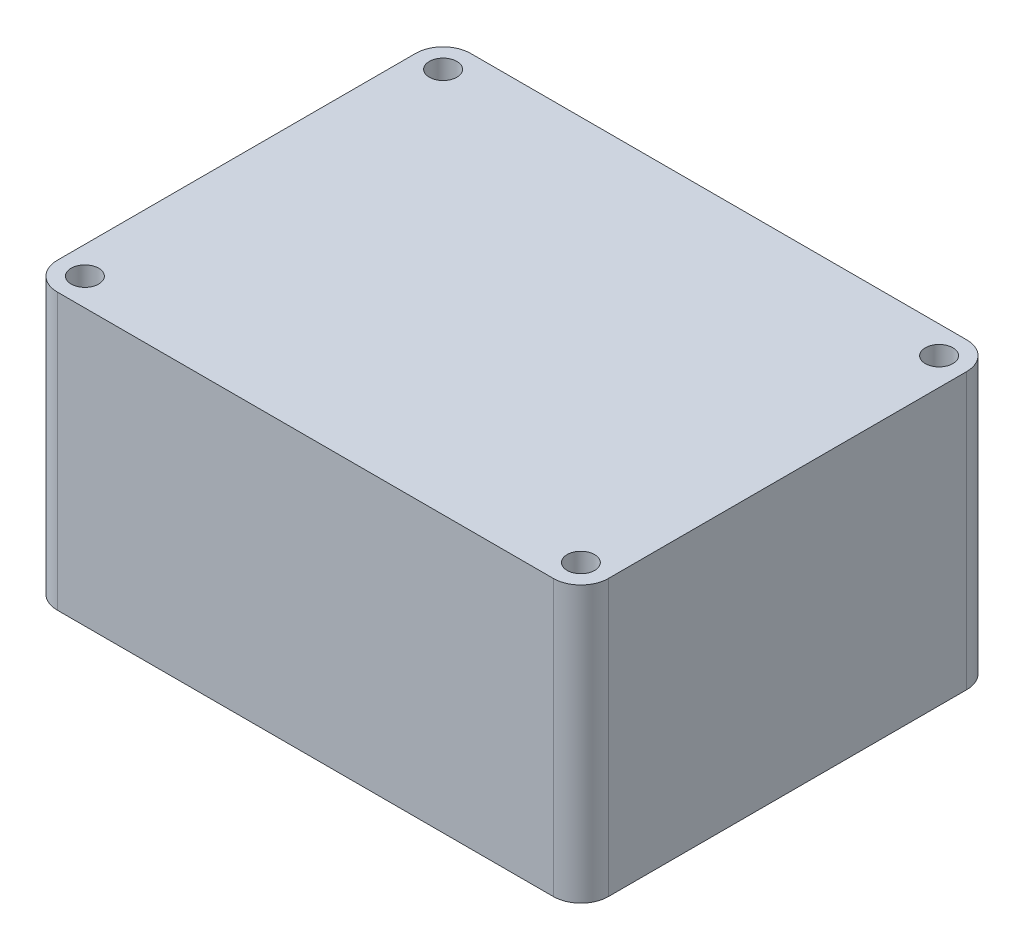
from build123d import *

# Parameters (mm, degrees)
CROQUIS1_W                                 = 200
CROQUIS1_H                                 = 150
SALIENTE_EXTRUIR1_DEPTH                    = 100
REDONDEO1_R                                = 10
CROQUIS2_R                                 = 5
CORTAR_EXTRUIR1_DEPTH                      = 161.078105936
SIMETR_A1_AT_THE_SECOND_PLANE_COPY_1_SKE_R = 5
SIMETR_A1_AT_THE_SECOND_PLANE_COPY_1_DEPTH = 161.078105936


with BuildPart() as part:
    # Croquis1 → Saliente-Extruir1 (new body)
    with BuildSketch(Plane(origin=(0, 0, 0), x_dir=(1, 0, 0), z_dir=(0, 1, 0))):
        Rectangle(CROQUIS1_W, CROQUIS1_H)
    extrude(amount=SALIENTE_EXTRUIR1_DEPTH)

    # Redondeo1
    redondeo1_edges = [part.edges().sort_by_distance(p)[0] for p in [
        (-100, 50, -75),
        (100, 50, -75),
        (100, 50, 75),
        (-100, 50, 75),
    ]]
    fillet(redondeo1_edges, radius=REDONDEO1_R)

    # Croquis2 → Cortar-Extruir1 (cut, through all)
    with BuildSketch(Plane(origin=(0, 100, 0), x_dir=(1, 0, 0), z_dir=(0, 1, 0))):
        with Locations(Location((-90, 65, 0), (0, 0, 270))):
            Circle(CROQUIS2_R)
    cortar_extruir1 = extrude(amount=-CORTAR_EXTRUIR1_DEPTH, mode=Mode.SUBTRACT)

    # Simetría1: Cortar-Extruir1 across plane
    add(cortar_extruir1.mirror(Plane.XY), mode=Mode.SUBTRACT)

    # Simetría1 at the second plane: Cortar-Extruir1 across plane
    add(cortar_extruir1.mirror(Plane(origin=(0, 0, 0), x_dir=(0, 0, 1), z_dir=(1, 0, 0))), mode=Mode.SUBTRACT)

    # Simetría1 at the second plane copy 1 ske → Simetría1 at the second plane copy 1 (cut, through all)
    with BuildSketch(Plane(origin=(0, 100, 0), x_dir=(-1, 0, 0), z_dir=(0, 1, 0))):
        with Locations(Location((-90, 65, 0), (0, 0, 270))):
            Circle(SIMETR_A1_AT_THE_SECOND_PLANE_COPY_1_SKE_R)
    extrude(amount=-SIMETR_A1_AT_THE_SECOND_PLANE_COPY_1_DEPTH, mode=Mode.SUBTRACT)


solid = part.part
